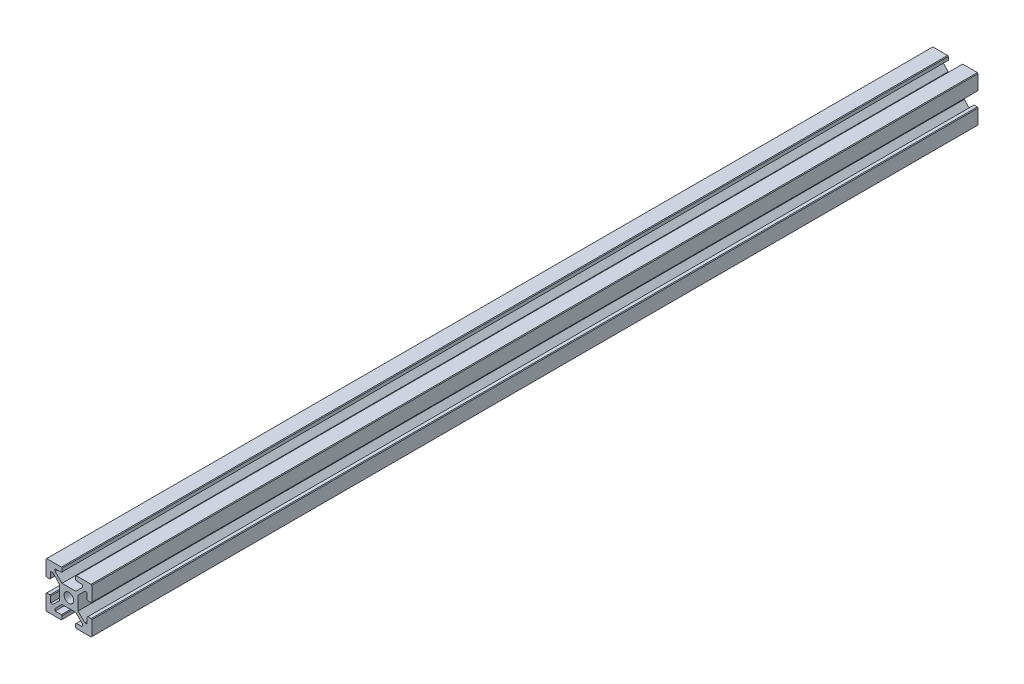
from build123d import *

# Parameters (mm, degrees)
SKETCH1_R           = 2.1
BOSS_EXTRUDE1_DEPTH = 387.35
CHAMFER1_SIZE       = 0.2828


with BuildPart() as part:
    # Sketch1 → Boss-Extrude1 (new body)
    with BuildSketch(Plane.XY):
        Polygon((-3, 8), (-3, 10), (-10, 10), (-10, 3), (-8, 3), (-8, 6), (-7, 6), (-4, 3), (-4, -3), (-7, -6), (-8, -6), (-8, -3), (-10, -3), (-10, -10), (-3, -10), (-3, -8), (-6, -8), (-6, -7), (-3, -4), (3, -4), (6, -7), (6, -8), (3, -8), (3, -10), (10, -10), (10, -3), (8, -3), (8, -6), (7, -6), (4, -3), (4, 3), (7, 6), (8, 6), (8, 3), (10, 3), (10, 10), (3, 10), (3, 8), (6, 8), (6, 7), (3, 4), (-3, 4), (-6, 7), (-6, 8), align=None)
        Circle(SKETCH1_R, mode=Mode.SUBTRACT)
    extrude(amount=BOSS_EXTRUDE1_DEPTH)

    # Chamfer1
    chamfer1_edges = [part.edges().sort_by_distance(p)[0] for p in [
        (-8, -3, 193.675),
        (-8, 3, 193.675),
        (-10, 3, 193.675),
        (-10, 10, 193.675),
        (-3, 10, 193.675),
        (-3, 8, 193.675),
        (3, 8, 193.675),
        (3, 10, 193.675),
        (10, 10, 193.675),
        (10, 3, 193.675),
        (8, 3, 193.675),
        (8, -3, 193.675),
        (10, -3, 193.675),
        (10, -10, 193.675),
        (3, -10, 193.675),
        (3, -8, 193.675),
        (-3, -8, 193.675),
        (-3, -10, 193.675),
        (-10, -10, 193.675),
        (-10, -3, 193.675),
    ]]
    chamfer(chamfer1_edges, length=CHAMFER1_SIZE)


solid = part.part
